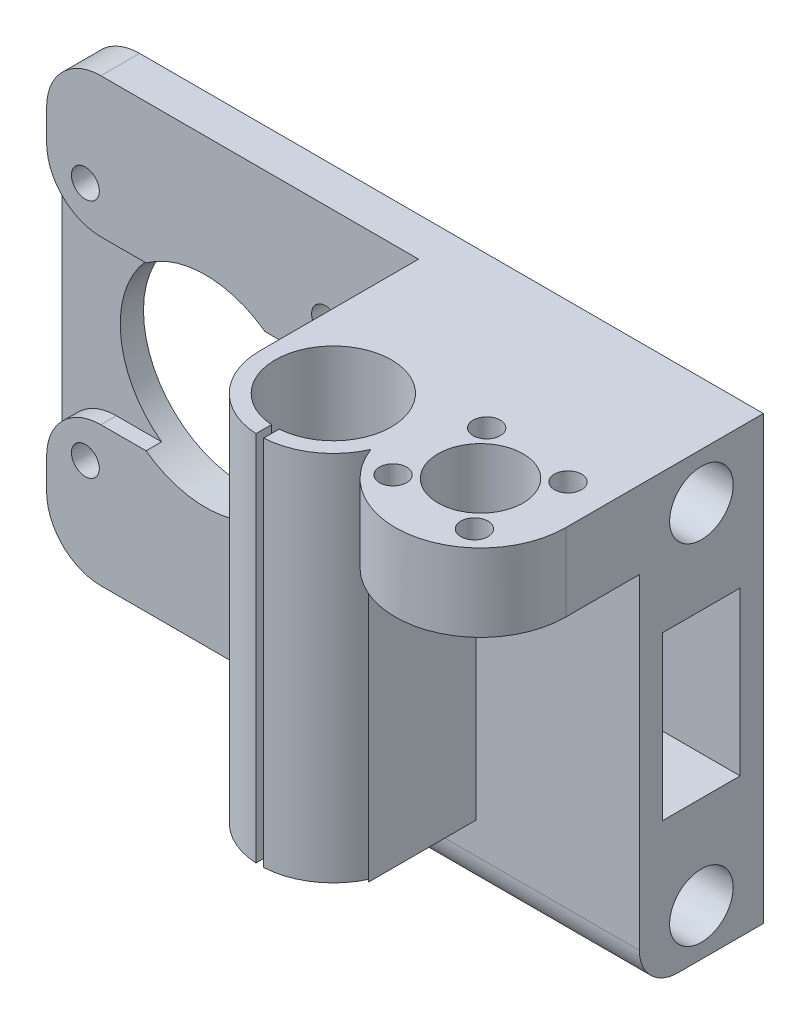
from build123d import *

# Parameters (mm, degrees)
SKETCH2_R             = 5.5
SKETCH2_R_2           = 1.75
BOSS_EXTRUDE1_DEPTH   = 28.5
CUT_EXTRUDE1_START    = 16
CUT_EXTRUDE1_DEPTH    = 83.998737366
SKETCH4_R             = 1.8
SKETCH4_R_2           = 13
HOLES_FOR_MOTOR_DEPTH = 99.998737366
SKETCH6_W             = 10
SKETCH6_H             = 21
CUT_EXTRUDE3_DEPTH    = 99.998737366
SKETCH11_R            = 4.1
CUT_EXTRUDE7_DEPTH    = 21.691
FILLET2_R             = 5
FILLET3_R             = 7


with BuildPart() as part:
    # Sketch2 → Boss-Extrude1 (new, symmetric)
    with BuildSketch(Plane(origin=(0, 0, 0), x_dir=(1, 0, 0), z_dir=(0, 1, 0))):
        with BuildLine():
            Line((58, -34.986832981), (58, -32.983314774))
            ThreePointArc((58, -32.983314774), (57.5, -18), (57, -32.983314774))
            Line((57, -32.983314774), (57, -34.986832981))
            ThreePointArc((57, -34.986832981), (50.607975624, -32.038348415), (48, -25.5))
            Line((48, -25.5), (48, -5))
            Line((48, -5), (0, -5))
            Line((0, -5), (0, 0))
            Line((0, 0), (87.5, 0))
            Line((87.5, 0), (87.5, -25.5))
            ThreePointArc((87.5, -25.5), (78.449190115, -36.325925267), (66.190789474, -29.336688458))
            ThreePointArc((66.190789474, -29.336688458), (62.894319797, -33.319930558), (58, -34.986832981))
        make_face()
        with Locations(Location((76.5, -25.5, 0), (0, 0, 90))):
            Circle(SKETCH2_R, mode=Mode.SUBTRACT)
        with Locations(Location((70.462323358, -30.748472232, 0), (0, 0, 90))):
            Circle(SKETCH2_R_2, mode=Mode.SUBTRACT)
        with Locations(Location((82.537676642, -20.251527768, 0), (0, 0, 90))):
            Circle(SKETCH2_R_2, mode=Mode.SUBTRACT)
        with Locations(Location((71.251527768, -19.462323358, 0), (0, 0, 90))):
            Circle(SKETCH2_R_2, mode=Mode.SUBTRACT)
        with Locations(Location((81.748472232, -31.537676642, 0), (0, 0, 90))):
            Circle(SKETCH2_R_2, mode=Mode.SUBTRACT)
    extrude(amount=BOSS_EXTRUDE1_DEPTH, both=True)

    # Sketch3 → Cut-Extrude1 (cut, through all)
    with BuildSketch(Plane.XY.offset(CUT_EXTRUDE1_START)):
        Polygon((66.4, 18.5), (88, 18.5), (88, -28.5), (48, -28.5), (48, -19.5), (66.4, -19.5), align=None)
    extrude(amount=CUT_EXTRUDE1_DEPTH, mode=Mode.SUBTRACT)

    # Sketch4 → Holes-for-motor (cut, through all)
    with BuildSketch(Plane.XY):
        with Locations(Location((5, 15.5, 0), (0, 0, 180))):
            Circle(SKETCH4_R)
        with Locations(Location((36, 15.5, 0), (0, 0, 180))):
            Circle(SKETCH4_R)
        with Locations(Location((5, -15.5, 0), (0, 0, 180))):
            Circle(SKETCH4_R)
        with Locations(Location((36, -15.5, 0), (0, 0, 180))):
            Circle(SKETCH4_R)
        with Locations(Location((20.5, 0, 0), (0, 0, 180))):
            Circle(SKETCH4_R_2)
    extrude(amount=HOLES_FOR_MOTOR_DEPTH, mode=Mode.SUBTRACT)

    # Sketch6 → Cut-Extrude3 (cut, through all)
    with BuildSketch(Plane(origin=(0, 0, 0), x_dir=(0, 0, -1), z_dir=(1, 0, 0))):
        with Locations((-8, 0)):
            Rectangle(SKETCH6_W, SKETCH6_H)
    extrude(amount=CUT_EXTRUDE3_DEPTH, mode=Mode.SUBTRACT)

    # Sketch11 → Cut-Extrude7 (cut)
    with BuildSketch(Plane(origin=(87.5, 0, 0), x_dir=(0, 0, -1), z_dir=(1, 0, 0))):
        with Locations((-8, -22.5)):
            Circle(SKETCH11_R)
        with Locations((-8, 22.5)):
            Circle(SKETCH11_R)
    extrude(amount=-CUT_EXTRUDE7_DEPTH, mode=Mode.SUBTRACT)

    # Fillet2
    fillet2_edges = [part.edges().sort_by_distance(p)[0] for p in [
        (67.75, -28.5, 16),
    ]]
    fillet(fillet2_edges, radius=FILLET2_R)

    # Fillet3
    fillet3_edges = [part.edges().sort_by_distance(p)[0] for p in [
        (0, -10.5, 4),
        (0, 10.5, 4),
        (0, -28.5, 2.5),
        (0, 28.5, 2.5),
    ]]
    fillet(fillet3_edges, radius=FILLET3_R)


solid = part.part
